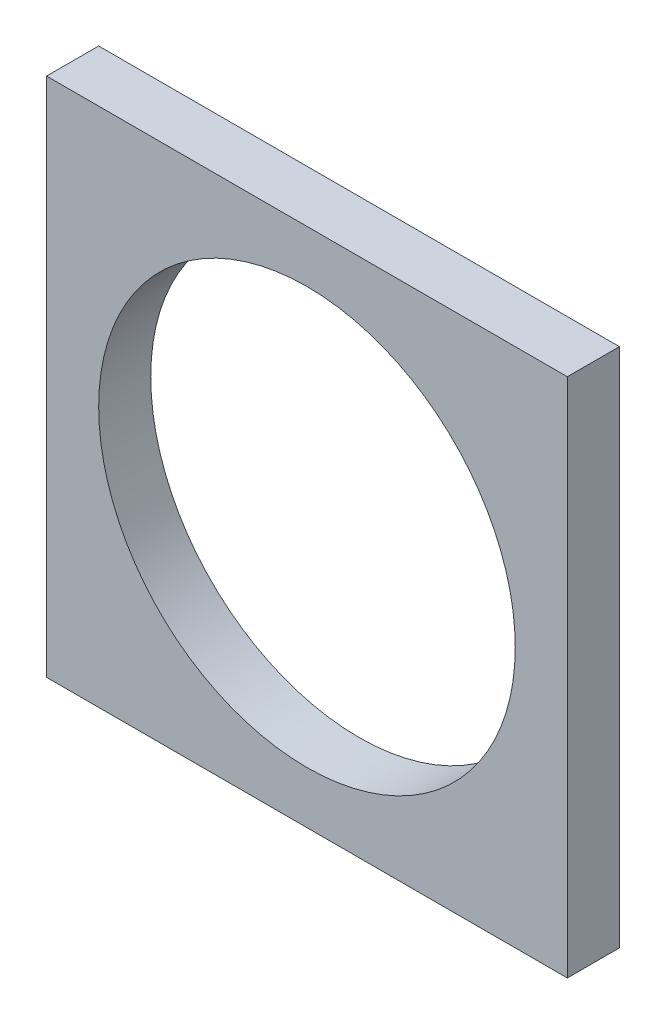
from build123d import *

# Parameters (mm, degrees)
SKETCH1_W           = 100
SKETCH1_H           = 100
SKETCH1_R           = 40
BOSS_EXTRUDE1_DEPTH = 10


with BuildPart() as part:
    # Sketch1 → Boss-Extrude1 (new body)
    with BuildSketch(Plane.XY):
        Rectangle(SKETCH1_W, SKETCH1_H)
        Circle(SKETCH1_R, mode=Mode.SUBTRACT)
    extrude(amount=BOSS_EXTRUDE1_DEPTH)


solid = part.part
